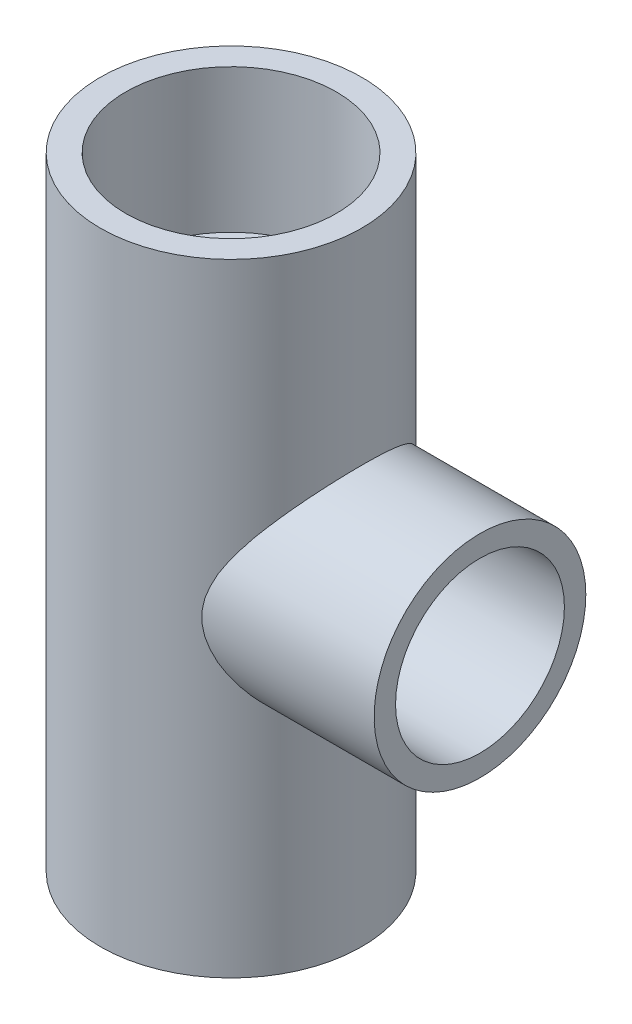
from build123d import *

# Parameters (mm, degrees)
SKETCH1_R               = 16.6751
SKETCH1_R_2             = 10.4648
BOSS_EXTRUDE1_DEPTH     = 39.6875
SKETCH2_R               = 13.5001
SKETCH2_R_2             = 7.8994
BOSS_EXTRUDE2_DEPTH     = 31.75
CUT_EXTRUDE3_REACH      = 66.793
CUT_EXTRUDE3_END_RADIUS = 10.4648
SKETCH4_R               = 7.8994
CUT_EXTRUDE4_START      = -79.375
SKETCH5_R               = 10.4648
CUT_EXTRUDE4_DEPTH      = 79.375
SKETCH6_R               = 10.7696
CUT_EXTRUDE5_DEPTH      = 17.526
SKETCH8_R               = 13.4366
CUT_EXTRUDE6_DEPTH      = 18.288


with BuildPart() as part:
    # Sketch1 → Boss-Extrude1 (new, symmetric)
    with BuildSketch(Plane(origin=(0, 0, 0), x_dir=(1, 0, 0), z_dir=(0, 1, 0))):
        with Locations(Location((0, 0, 0), (0, 0, 90))):
            Circle(SKETCH1_R)
        with Locations(Location((0, 0, 0), (0, 0, 90))):
            Circle(SKETCH1_R_2, mode=Mode.SUBTRACT)
    extrude(amount=BOSS_EXTRUDE1_DEPTH, both=True)

    # Cut-Extrude3: up to this cylinder (the profile starts outside it)
    cut_extrude3_end = Plane(origin=(0, 0, 0), z_dir=(0, -1, 0)) * Cylinder(CUT_EXTRUDE3_END_RADIUS, 155.5156, mode=Mode.PRIVATE)
    # Sketch4 → Cut-Extrude3 (cut, up to the surface)
    with BuildSketch(Plane(origin=(31.75, 0, 0), x_dir=(0, 0, -1), z_dir=(1, 0, 0)), mode=Mode.PRIVATE) as cut_extrude3_sk1:
        Circle(SKETCH4_R)
    cut_extrude3_tool1 = extrude(cut_extrude3_sk1.sketch, amount=-CUT_EXTRUDE3_REACH, mode=Mode.PRIVATE) - cut_extrude3_end
    add(cut_extrude3_tool1.solids().sort_by_distance((31.75, 0, 0))[0], mode=Mode.SUBTRACT)


with BuildPart() as body_2:
    # Sketch2 → Boss-Extrude2 (new body)
    with BuildSketch(Plane(origin=(0, 0, 0), x_dir=(0, 0, -1), z_dir=(1, 0, 0))):
        Circle(SKETCH2_R)
        Circle(SKETCH2_R_2, mode=Mode.SUBTRACT)
    extrude(amount=BOSS_EXTRUDE2_DEPTH)

    # Sketch5 → Cut-Extrude4 (cut)
    with BuildSketch(Plane(origin=(0, 39.6875, 0), x_dir=(1, 0, 0), z_dir=(0, 1, 0)).offset(CUT_EXTRUDE4_START)):
        with Locations(Location((0, 0, 0), (0, 0, 270))):
            Circle(SKETCH5_R)
    extrude(amount=CUT_EXTRUDE4_DEPTH, mode=Mode.SUBTRACT)


with BuildPart() as cut_extrude5_tool:
    # Sketch6 → Cut-Extrude5 (new body)
    with BuildSketch(Plane(origin=(31.75, 0, 0), x_dir=(0, 0, -1), z_dir=(1, 0, 0))):
        Circle(SKETCH6_R)
    extrude(amount=-CUT_EXTRUDE5_DEPTH)


with BuildPart() as part_1:
    add(part.part)

    # Cut-Extrude5: cut by cut_extrude5_tool
    add(cut_extrude5_tool.part, mode=Mode.SUBTRACT)

    # Sketch8 → Cut-Extrude6 (cut)
    with BuildSketch(Plane(origin=(0, 39.6875, 0), x_dir=(1, 0, 0), z_dir=(0, 1, 0))):
        with Locations(Location((0, 0, 0), (0, 0, 270))):
            Circle(SKETCH8_R)
    cut_extrude6 = extrude(amount=-CUT_EXTRUDE6_DEPTH, mode=Mode.SUBTRACT)

    # Mirror1: Cut-Extrude6 across plane
    add(cut_extrude6.mirror(Plane.ZX), mode=Mode.SUBTRACT)


with BuildPart() as body_2_1:
    add(body_2.part)

    # Cut-Extrude5: cut by cut_extrude5_tool
    add(cut_extrude5_tool.part, mode=Mode.SUBTRACT)


solid = Compound([part_1.part, body_2_1.part])
